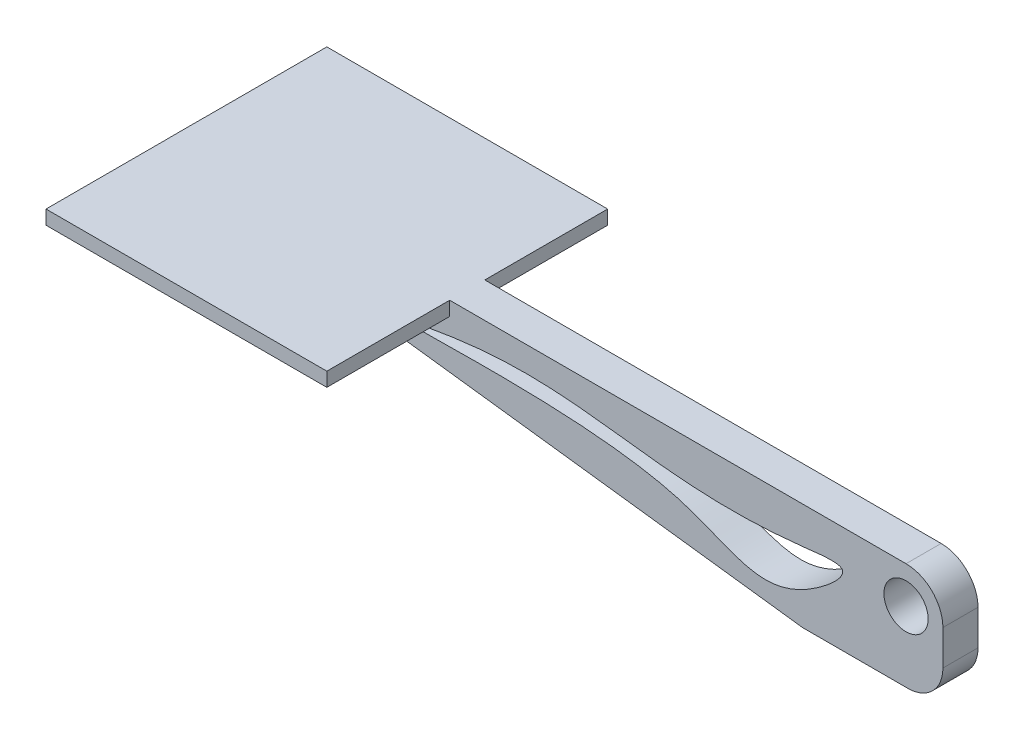
from build123d import *

# Parameters (mm, degrees)
BOSS_EXTRUDE2_DEPTH      = 5
BOSS_EXTRUDE2_DEPTH_BACK = 5
SKETCH1_R                = 6.3
BOSS_EXTRUDE5_DEPTH      = 4


with BuildPart() as part:
    # Sketch1 → Boss-Extrude2 (new, two sides: drawn at the far end of the back side and taken through both)
    with BuildSketch(Plane.XY.offset(-BOSS_EXTRUDE2_DEPTH_BACK)):
        with BuildLine():
            Line((-202.516579197, -2.205597272), (-171.261467059, -2.205597272))
            ThreePointArc((-171.261467059, -2.205597272), (-170.002501752, -2.245261445), (-168.748530027, -2.364096637))
            Line((-168.748530027, -2.364096637), (-29.5, -20))
            Line((-29.5, -20), (0.5, -20))
            ThreePointArc((0.5, -20), (7.571067812, -17.071067812), (10.5, -10))
            Line((10.5, -10), (10.5, 0))
            ThreePointArc((10.5, 0), (7.424621202, 7.424621202), (0, 10.5))
            Line((0, 10.5), (-170, 10.5))
            Line((-170, 10.5), (-210.016579197, 10.5))
            Line((-210.016579197, 10.5), (-210.016579197, 5.294402728))
            ThreePointArc((-210.016579197, 5.294402728), (-207.819880056, -0.008898131), (-202.516579197, -2.205597272))
        make_face()
        with BuildLine():
            add(Edge.make_bspline(
                [(-29.5, 0), (-71.215452784, -4.618921443), (-91.249553359, 8.295604419), (-167.314221678, -4.516378239), (-66.660462753, 5.705990527), (-39.354743787, -20.82364873), (-11.877374637, 2.389635503), (-24.523342717, 0.551037745), (-29.5, 0)],
                knots=[0, 0, 0, 0, 0.381705307, 0.445280413, 0.748987596, 0.89187549, 0.954462522, 1, 1, 1, 1], degree=3))
        make_face(mode=Mode.SUBTRACT)
        Circle(SKETCH1_R, mode=Mode.SUBTRACT)
    extrude(amount=BOSS_EXTRUDE2_DEPTH + BOSS_EXTRUDE2_DEPTH_BACK)

    # Sketch2 → Boss-Extrude5 (add)
    with BuildSketch(Plane(origin=(0, 10.5, 0), x_dir=(1, 0, 0), z_dir=(0, 1, 0))):
        Polygon((-210, -40), (-130, -40), (-130, 0), (-130, 40), (-210, 40), align=None)
    extrude(amount=-BOSS_EXTRUDE5_DEPTH)


solid = part.part
